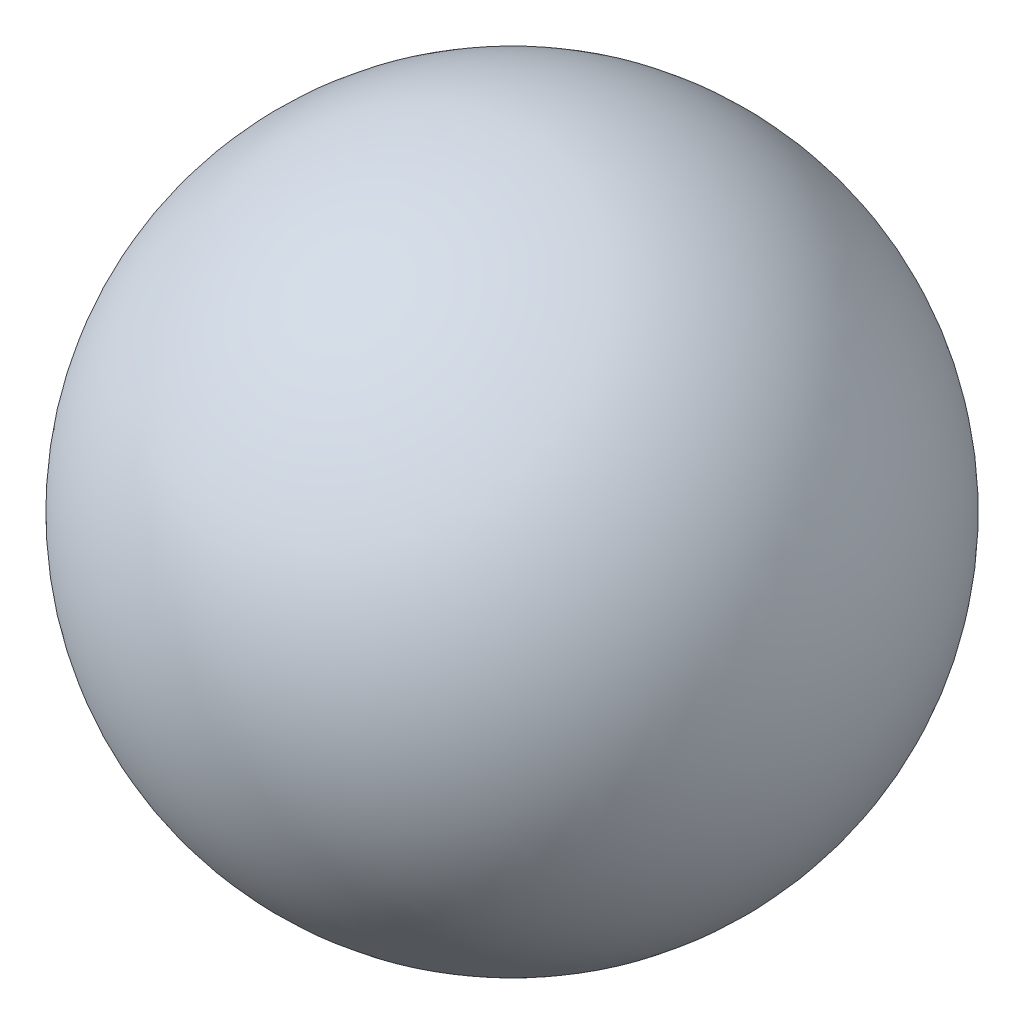
from build123d import *


with BuildPart() as part:
    # Sketch1 → Revolve1 (revolve)
    with BuildSketch(Plane.XY):
        with BuildLine():
            Line((0, 21.5), (0, 16.75))
            ThreePointArc((0, 16.75), (-16.75, 0), (0, -16.75))
            Line((0, -16.75), (0, -21.5))
            ThreePointArc((0, -21.5), (-21.5, 0), (0, 21.5))
        make_face()
    revolve(axis=Axis((0, 105.084210526, 0), (0, -1, 0)))


solid = part.part
